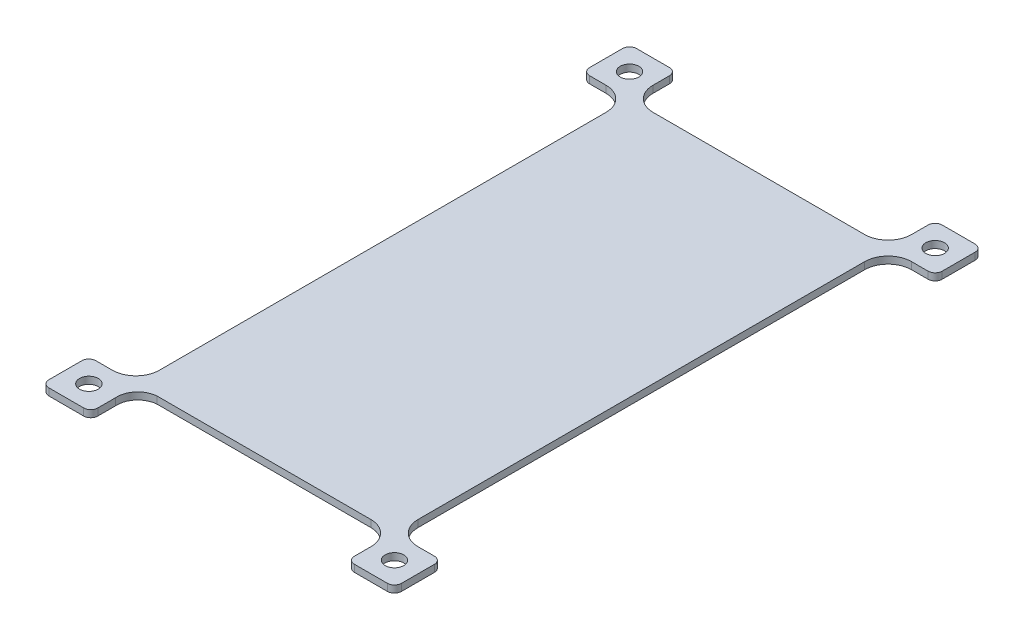
from build123d import *

# Parameters (mm, degrees)
SKETCH1_R           = 3.96875
BOSS_EXTRUDE1_DEPTH = 3
FILLET1_R           = 3
SKETCH9_R           = 4.7625
BOSS_EXTRUDE3_DEPTH = 5


with BuildPart() as part:
    # Sketch1 → Boss-Extrude1 (new body)
    with BuildSketch(Plane(origin=(0, 0, 0), x_dir=(1, 0, 0), z_dir=(0, 1, 0))):
        with BuildLine():
            Line((45, 105), (-45, 105))
            ThreePointArc((-45, 105), (-52.071067812, 107.928932188), (-55, 115))
            Line((-55, 115), (-55, 125))
            Line((-55, 125), (-75, 125))
            Line((-75, 125), (-75, 105))
            Line((-75, 105), (-65, 105))
            ThreePointArc((-65, 105), (-57.928932188, 102.071067812), (-55, 95))
            Line((-55, 95), (-55, -95))
            ThreePointArc((-55, -95), (-57.928932188, -102.071067812), (-65, -105))
            Line((-65, -105), (-75, -105))
            Line((-75, -105), (-75, -125))
            Line((-75, -125), (-54.202059137, -125))
            Line((-54.202059137, -125), (-54.202059137, -114.538060718))
            ThreePointArc((-54.202059137, -114.538060718), (-54.227177014, -113.870059928), (-54.202059137, -113.202059137))
            ThreePointArc((-54.202059137, -113.202059137), (-51.621839755, -107.580219382), (-46, -105))
            Line((-46, -105), (45, -105))
            ThreePointArc((45, -105), (52.04921496, -107.95078504), (55, -115))
            Line((55, -115), (55, -125))
            Line((55, -125), (75, -125))
            Line((75, -125), (75, -105))
            Line((75, -105), (65, -105))
            ThreePointArc((65, -105), (57.928932188, -102.071067812), (55, -95))
            Line((55, -95), (55, 95))
            ThreePointArc((55, 95), (57.928932188, 102.071067812), (65, 105))
            Line((65, 105), (75, 105))
            Line((75, 105), (75, 125))
            Line((75, 125), (55, 125))
            Line((55, 125), (55, 115))
            ThreePointArc((55, 115), (52.071067812, 107.928932188), (45, 105))
        make_face()
        with Locations(Location((-65, -115, 0), (0, 0, 270))):
            Circle(SKETCH1_R, mode=Mode.SUBTRACT)
        with Locations(Location((65, -115, 0), (0, 0, 270))):
            Circle(SKETCH1_R, mode=Mode.SUBTRACT)
        with Locations(Location((-65, 115, 0), (0, 0, 270))):
            Circle(SKETCH1_R, mode=Mode.SUBTRACT)
        with Locations(Location((65, 115, 0), (0, 0, 270))):
            Circle(SKETCH1_R, mode=Mode.SUBTRACT)
    extrude(amount=BOSS_EXTRUDE1_DEPTH)

    # Fillet1
    fillet1_edges = [part.edges().sort_by_distance(p)[0] for p in [
        (55, 1.5, -125),
        (75, 1.5, -125),
        (75, 1.5, -105),
        (75, 1.5, 105),
        (75, 1.5, 125),
        (55, 1.5, 125),
        (-54.202059137, 1.5, 125),
        (-75, 1.5, 125),
        (-75, 1.5, 105),
        (-75, 1.5, -105),
        (-75, 1.5, -125),
        (-55, 1.5, -125),
    ]]
    fillet(fillet1_edges, radius=FILLET1_R)

    # Sketch9 → Boss-Extrude3 (add, symmetric)
    with BuildSketch(Plane(origin=(0, 0, 0), x_dir=(0, 0, -1), z_dir=(1, 0, 0))):
        with BuildLine():
            Line((-15, 0), (15, 0))
            Line((15, 0), (15, -15.6))
            ThreePointArc((15, -15.6), (10.782337649, -25.782337649), (0.6, -30))
            Line((0.6, -30), (-0.6, -30))
            ThreePointArc((-0.6, -30), (-10.782337649, -25.782337649), (-15, -15.6))
            Line((-15, -15.6), (-15, 0))
        make_face()
        with Locations((0, -15)):
            Circle(SKETCH9_R, mode=Mode.SUBTRACT)
    extrude(amount=BOSS_EXTRUDE3_DEPTH, both=True)


solid = part.part
